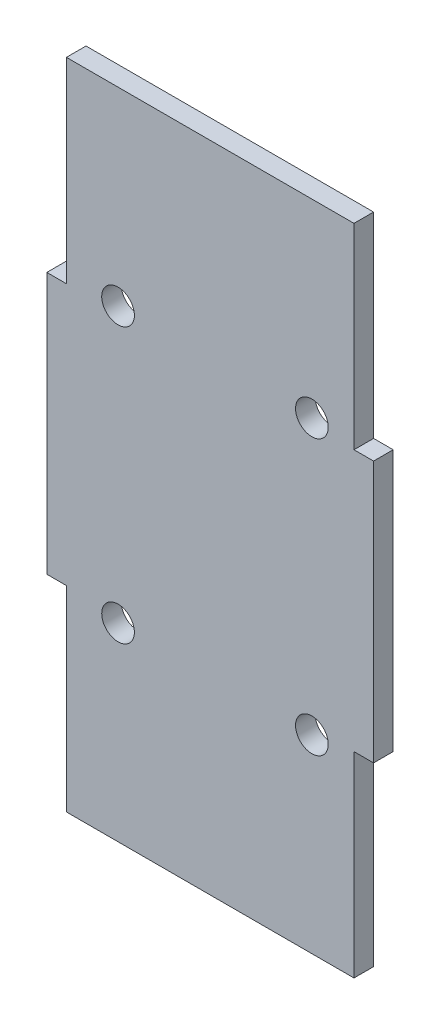
from build123d import *

# Parameters (mm, degrees)
SKETCH1_R           = 2.5
BOSS_EXTRUDE1_DEPTH = 3


with BuildPart() as part:
    # Sketch1 → Boss-Extrude1 (new body)
    with BuildSketch(Plane.XY):
        Polygon((-25, 9.275362319), (-22, 9.275362319), (-22, 39.275362319), (22, 39.275362319), (22, 9.275362319), (25, 9.275362319), (25, -30.724637681), (22, -30.724637681), (22, -60.724637681), (-22, -60.724637681), (-22, -30.724637681), (-25, -30.724637681), align=None)
        with Locations((15.558956534, 10.275362319)):
            Circle(SKETCH1_R, mode=Mode.SUBTRACT)
        with Locations((-14.098613638, 10.275362319)):
            Circle(SKETCH1_R, mode=Mode.SUBTRACT)
        with Locations(Location((15.558956534, -31.724637681, 0), (0, 0, 180))):
            Circle(SKETCH1_R, mode=Mode.SUBTRACT)
        with Locations(Location((-14.098613638, -31.724637681, 0), (0, 0, 180))):
            Circle(SKETCH1_R, mode=Mode.SUBTRACT)
    extrude(amount=BOSS_EXTRUDE1_DEPTH)


solid = part.part
